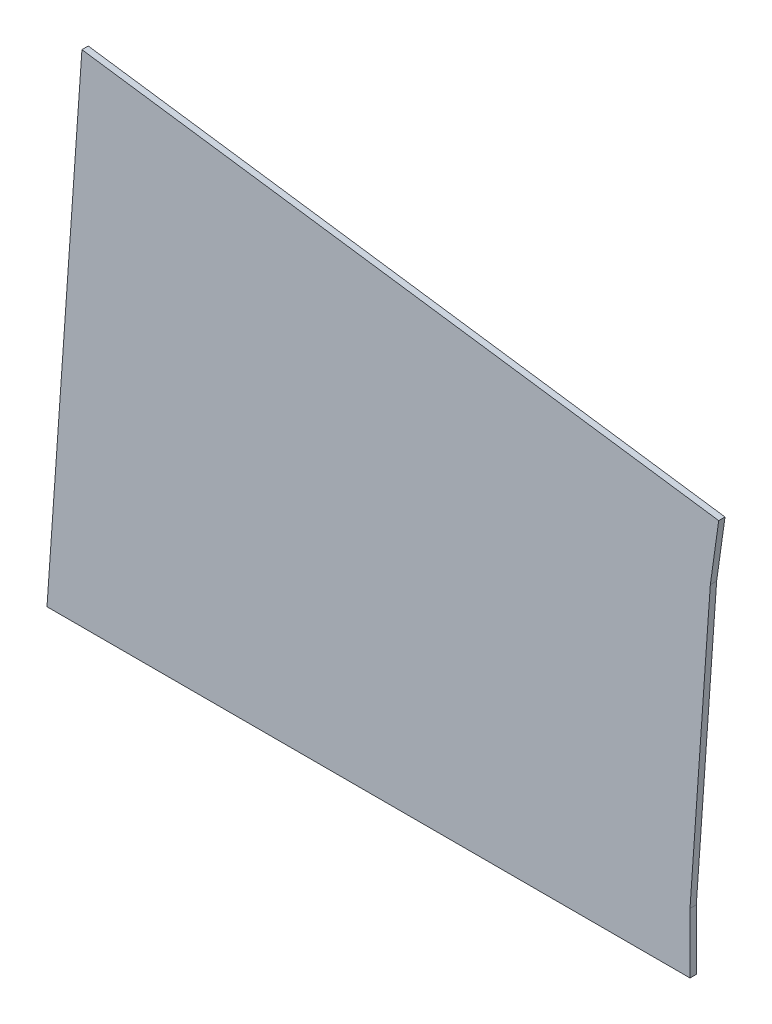
from build123d import *

# Parameters (mm, degrees)
BOSS_EXTRUDE1_DEPTH = 2


with BuildPart() as part:
    # Sketch1 → Boss-Extrude1 (new body)
    with BuildSketch(Plane.XY):
        Polygon((100, -9.525), (100, 9.525), (106.424390598, 101.398065839), (109.075638171, 120.262672549), (-92.282489788, 148.561711926), (-103.336989564, -9.525), align=None)
    extrude(amount=BOSS_EXTRUDE1_DEPTH)


solid = part.part
